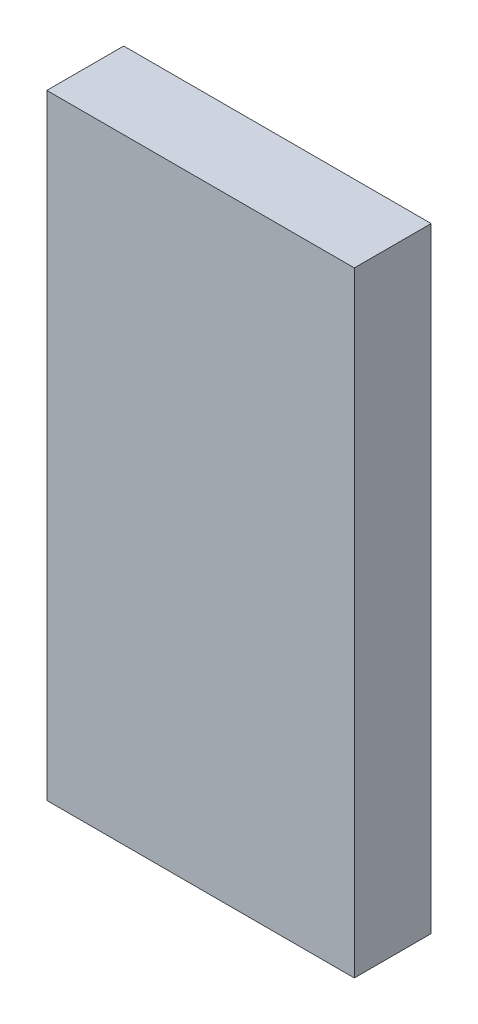
from build123d import *

# Parameters (mm, degrees)
SKETCH1_W           = 12.7
SKETCH1_H           = 25.4
BOSS_EXTRUDE1_DEPTH = 3.175


with BuildPart() as part:
    # Sketch1 → Boss-Extrude1 (new body)
    with BuildSketch(Plane.XY):
        with Locations((6.35, 12.7)):
            Rectangle(SKETCH1_W, SKETCH1_H)
    extrude(amount=BOSS_EXTRUDE1_DEPTH)


solid = part.part
